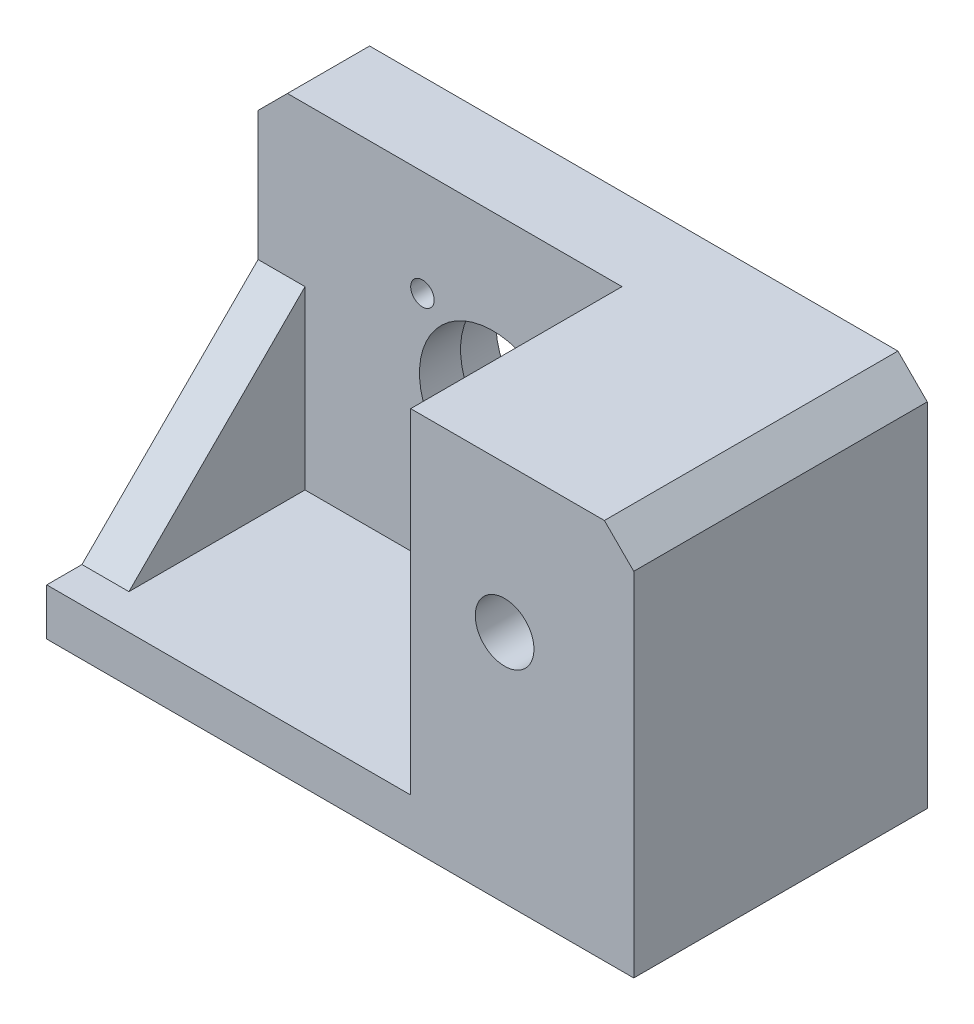
from build123d import *

# Parameters (mm, degrees)
SKETCH1_R             = 13.5
BOSS_EXTRUDE1_DEPTH   = 14
BOSS_EXTRUDE2_START   = -7
SKETCH2_R             = 13.5
SKETCH2_R_2           = 12.5
BOSS_EXTRUDE2_DEPTH   = 7
F_4_0MM_DOWEL_HOLE1_D = 4
SKETCH16_W            = 100
SKETCH16_H            = 50
BOSS_EXTRUDE3_DEPTH   = 8
BOSS_EXTRUDE4_DEPTH   = 8
CHAMFER2_SIZE         = 5
SKETCH18_W            = 38
SKETCH18_H            = 65
BOSS_EXTRUDE5_DEPTH   = 44
SKETCH15_R            = 5
CUT_EXTRUDE1_DEPTH    = 86.586213843
CHAMFER3_SIZE         = 5


with BuildPart() as part:
    # Sketch1 → Boss-Extrude1 (new body)
    with BuildSketch(Plane.XY):
        Polygon((-40, 0), (-40, -35), (60, -35), (60, 3.080013472), (60, 30), (-40, 30), align=None)
        Circle(SKETCH1_R, mode=Mode.SUBTRACT)
    extrude(amount=BOSS_EXTRUDE1_DEPTH)

    # Sketch2 → Boss-Extrude2 (add)
    with BuildSketch(Plane.XY.offset(14).offset(BOSS_EXTRUDE2_START)):
        Circle(SKETCH2_R)
        Circle(SKETCH2_R_2, mode=Mode.SUBTRACT)
    extrude(amount=BOSS_EXTRUDE2_DEPTH)

    # Ø4.0mm Dowel Hole1 (through all)
    with Locations(Plane.XY.offset(14)):
        with Locations((-12, 12), (12, 12), (12, -12), (-12, -12)):
            Hole(F_4_0MM_DOWEL_HOLE1_D / 2)

    # Sketch16 → Boss-Extrude3 (add)
    with BuildSketch(Plane.XZ.offset(35)):
        with Locations((10, 25)):
            Rectangle(SKETCH16_W, SKETCH16_H)
    extrude(amount=-BOSS_EXTRUDE3_DEPTH)

    # Sketch17 → Boss-Extrude4 (add)
    with BuildSketch(Plane(origin=(60, 0, 0), x_dir=(0, 0, -1), z_dir=(1, 0, 0))):
        Polygon((-44, -27), (-14, 3), (-14, -27), align=None)
    boss_extrude4 = extrude(amount=-BOSS_EXTRUDE4_DEPTH)

    # Mirror1: Boss-Extrude4 across plane
    add(boss_extrude4.mirror(Plane(origin=(10, 0, 0), x_dir=(0, 0, 1), z_dir=(1, 0, 0))))

    # Chamfer2
    chamfer2_edges = [part.edges().sort_by_distance(p)[0] for p in [
        (-40, 30, 7),
    ]]
    chamfer(chamfer2_edges, length=CHAMFER2_SIZE)

    # Sketch18 → Boss-Extrude5 (add)
    with BuildSketch(Plane.XY.offset(50)):
        with Locations((41, -2.5)):
            Rectangle(SKETCH18_W, SKETCH18_H)
    extrude(amount=-BOSS_EXTRUDE5_DEPTH)

    # Sketch15 → Cut-Extrude1 (cut, through all)
    with BuildSketch(Plane(origin=(0, 0, 0), x_dir=(-1, 0, 0), z_dir=(0, 0, -1))):
        with Locations((-38, 5)):
            Circle(SKETCH15_R)
    extrude(amount=-CUT_EXTRUDE1_DEPTH, mode=Mode.SUBTRACT)

    # Chamfer3
    chamfer3_edges = [part.edges().sort_by_distance(p)[0] for p in [
        (60, 30, 25),
    ]]
    chamfer(chamfer3_edges, length=CHAMFER3_SIZE)


solid = part.part
